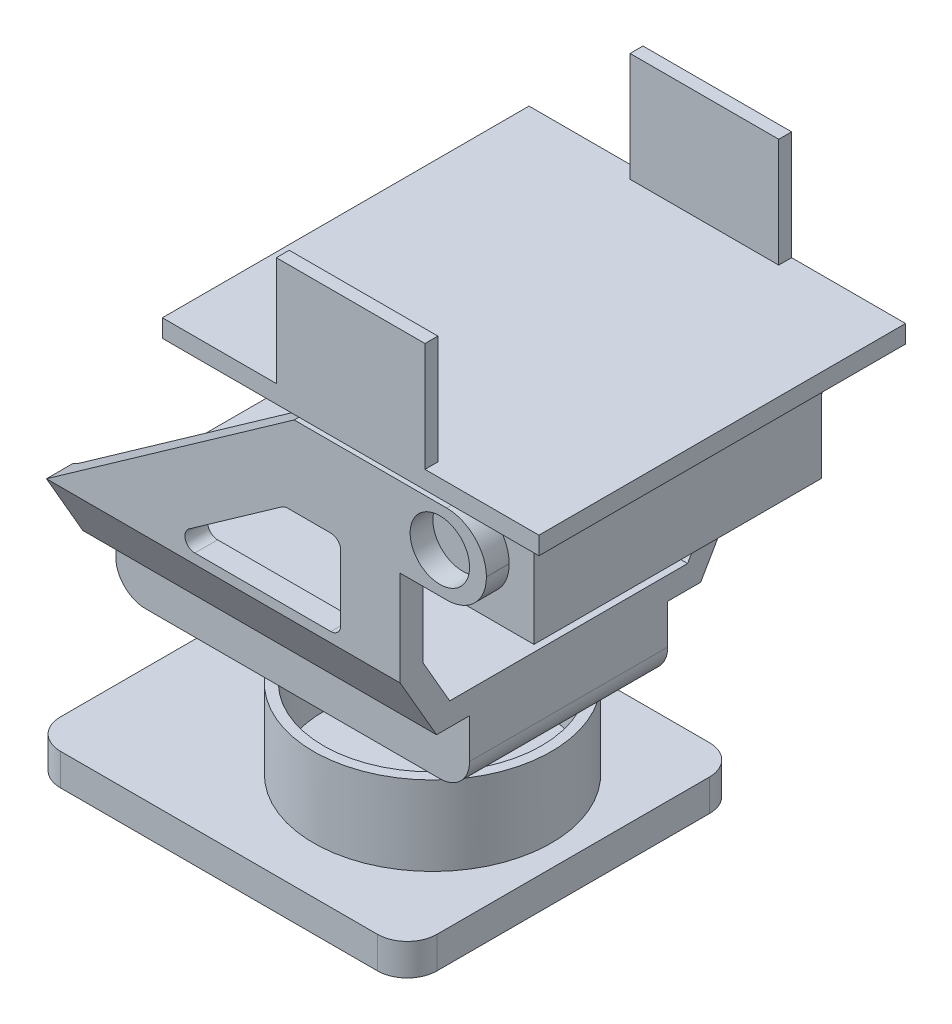
from build123d import *

# Parameters (mm, degrees)
SALIENTE_EXTRUIR1_DEPTH = 3.2
CROQUIS2_R              = 12
CROQUIS2_R_2            = 11
SALIENTE_EXTRUIR2_DEPTH = 8
CROQUIS3_W              = 22.22
CROQUIS3_H              = 2
SALIENTE_EXTRUIR3_DEPTH = 6
SALIENTE_EXTRUIR4_DEPTH = 10
SALIENTE_EXTRUIR5_DEPTH = 35.7
CORTAR_EXTRUIR1_DEPTH   = 45
CROQUIS7_R              = 3
SALIENTE_EXTRUIR6_DEPTH = 2.3
CROQUIS8_W              = 23
CROQUIS8_H              = 12
SALIENTE_EXTRUIR7_DEPTH = 14.5
CROQUIS9_W              = 38
CROQUIS9_H              = 1.8
SALIENTE_EXTRUIR8_DEPTH = 18.5
CROQUIS10_W             = 7.5
CROQUIS10_H             = 11
SALIENTE_EXTRUIR9_DEPTH = 1.3


with BuildPart() as part:
    # Croquis1 → Saliente-Extruir1 (new body)
    with BuildSketch(Plane(origin=(0, 0, 0), x_dir=(1, 0, 0), z_dir=(0, 1, 0))):
        with BuildLine():
            Line((-16, -16.75), (16, -16.75))
            ThreePointArc((16, -16.75), (18.121320344, -15.871320344), (19, -13.75))
            Line((19, -13.75), (19, 13.75))
            ThreePointArc((19, 13.75), (18.121320344, 15.871320344), (16, 16.75))
            Line((16, 16.75), (-16, 16.75))
            ThreePointArc((-16, 16.75), (-18.121320344, 15.871320344), (-19, 13.75))
            Line((-19, 13.75), (-19, -13.75))
            ThreePointArc((-19, -13.75), (-18.121320344, -15.871320344), (-16, -16.75))
        make_face()
    extrude(amount=SALIENTE_EXTRUIR1_DEPTH)

    # Croquis2 → Saliente-Extruir2 (add)
    with BuildSketch(Plane(origin=(0, 3.2, 0), x_dir=(1, 0, 0), z_dir=(0, 1, 0))):
        with Locations(Location((4.8, 0, 0), (0, 0, 90))):
            Circle(CROQUIS2_R)
        with Locations(Location((4.8, 0, 0), (0, 0, 270))):
            Circle(CROQUIS2_R_2, mode=Mode.SUBTRACT)
    extrude(amount=SALIENTE_EXTRUIR2_DEPTH)

    # Croquis3 → Saliente-Extruir3 (add, symmetric)
    with BuildSketch(Plane.XY):
        with Locations((0.69, 12.2)):
            Rectangle(CROQUIS3_W, CROQUIS3_H)
    extrude(amount=SALIENTE_EXTRUIR3_DEPTH, both=True)

    # Croquis4 → Saliente-Extruir4 (add, symmetric)
    with BuildSketch(Plane.XY):
        with BuildLine():
            Line((18.54, 20.2), (-17.16, 20.2))
            Line((-17.16, 20.2), (-17.16, 16.2))
            ThreePointArc((-17.16, 16.2), (-16.281320344, 14.078679656), (-14.16, 13.2))
            Line((-14.16, 13.2), (15.54, 13.2))
            ThreePointArc((15.54, 13.2), (17.661320344, 14.078679656), (18.54, 16.2))
            Line((18.54, 16.2), (18.54, 20.2))
        make_face()
    extrude(amount=SALIENTE_EXTRUIR4_DEPTH, both=True)

    # Croquis5 → Saliente-Extruir5 (add)
    with BuildSketch(Plane(origin=(18.54, 0, 0), x_dir=(0, 0, -1), z_dir=(1, 0, 0))):
        Polygon((0, 20.2), (0, 22.5), (-12, 22.5), (-14.7, 27.17653718), (-14.7, 44.2), (-17, 44.2), (-17, 26.560254038), (-13.327905619, 20.2), (-10, 20.2), align=None)
        Polygon((12, 22.5), (0, 22.5), (0, 20.2), (10, 20.2), (13.327905619, 20.2), (17, 26.560254038), (17, 44.2), (14.7, 44.2), (14.7, 27.17653718), align=None)
    extrude(amount=-SALIENTE_EXTRUIR5_DEPTH)

    # Croquis6 → Cortar-Extruir1 (cut, symmetric)
    with BuildSketch(Plane.XY):
        Polygon((-17.16, 26.560254038), (7.84, 44.2), (-17.16, 44.2), align=None)
        with BuildLine():
            Line((-2.18375281, 27.560254038), (11.54, 27.560254038))
            ThreePointArc((11.54, 27.560254038), (12.247106781, 27.853147257), (12.54, 28.560254038))
            Line((12.54, 28.560254038), (12.54, 35.160254038))
            ThreePointArc((12.54, 35.160254038), (12.247106781, 35.867360819), (11.54, 36.160254038))
            Line((11.54, 36.160254038), (7.170123394, 36.160254038))
            ThreePointArc((7.170123394, 36.160254038), (6.867700223, 36.113427803), (6.59359973, 35.97733449))
            Line((6.59359973, 35.97733449), (-2.760276474, 29.37733449))
            ThreePointArc((-2.760276474, 29.37733449), (-3.136926575, 28.257830867), (-2.18375281, 27.560254038))
        make_face()
    extrude(amount=CORTAR_EXTRUIR1_DEPTH, both=True, mode=Mode.SUBTRACT)

    # Croquis7 → Saliente-Extruir6 (add)
    with BuildSketch(Plane(origin=(0, 0, -17), x_dir=(-1, 0, 0), z_dir=(0, 0, -1))):
        with BuildLine():
            Line((-18.54, 44.2), (-23.24, 44.2))
            ThreePointArc((-23.24, 44.2), (-26.068427125, 43.028427125), (-27.24, 40.2))
            Line((-27.24, 40.2), (-27.24, 40.160254038))
            ThreePointArc((-27.24, 40.160254038), (-26.068427125, 37.331826913), (-23.24, 36.160254038))
            Line((-23.24, 36.160254038), (-18.54, 36.160254038))
            Line((-18.54, 36.160254038), (-18.54, 44.2))
        make_face()
        with Locations((-22.54, 40.180127019)):
            Circle(CROQUIS7_R, mode=Mode.SUBTRACT)
    saliente_extruir6 = extrude(amount=-SALIENTE_EXTRUIR6_DEPTH)

    # Simetría1: Saliente-Extruir6 across plane
    add(saliente_extruir6.mirror(Plane.XY))


with BuildPart() as body_2:
    # Croquis8 → Saliente-Extruir7 (new, symmetric)
    with BuildSketch(Plane.XY):
        with Locations((18.04, 40.180127019)):
            Rectangle(CROQUIS8_W, CROQUIS8_H)
    extrude(amount=SALIENTE_EXTRUIR7_DEPTH, both=True)

    # Croquis9 → Saliente-Extruir8 (add, symmetric)
    with BuildSketch(Plane.XY):
        with Locations((15.04, 47.080127019)):
            Rectangle(CROQUIS9_W, CROQUIS9_H)
    extrude(amount=SALIENTE_EXTRUIR8_DEPTH, both=True)

    # Croquis10 → Saliente-Extruir9 (add)
    with BuildSketch(Plane.XY.offset(18.5)):
        with Locations((11.29, 53.480127019)):
            Rectangle(CROQUIS10_W, CROQUIS10_H)
        with Locations((18.79, 53.480127019)):
            Rectangle(CROQUIS10_W, CROQUIS10_H)
    saliente_extruir9 = extrude(amount=-SALIENTE_EXTRUIR9_DEPTH)

    # Simetría2: Saliente-Extruir9 across plane
    add(saliente_extruir9.mirror(Plane.XY))


solid = Compound([part.part, body_2.part])
